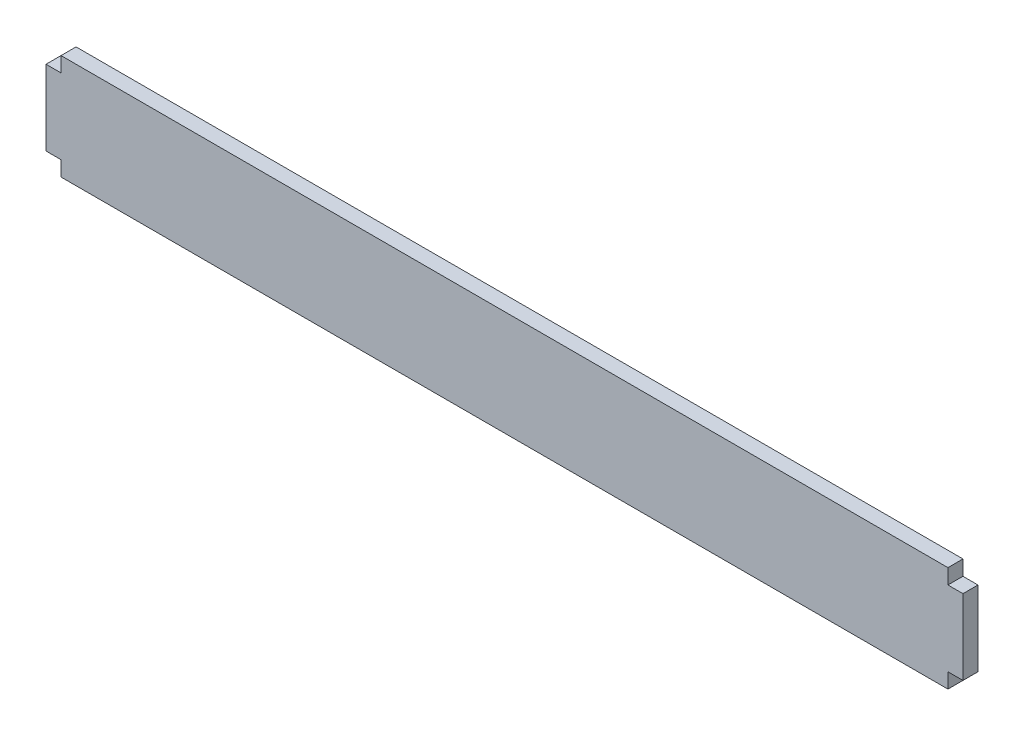
from build123d import *

# Parameters (mm, degrees)
SKETCH1_W           = 295
SKETCH1_H           = 35
SKETCH1_W_2         = 5
SKETCH1_H_2         = 25
BOSS_EXTRUDE1_DEPTH = 5


with BuildPart() as part:
    # Sketch1 → Boss-Extrude1 (new body)
    with BuildSketch(Plane.XY):
        with Locations((-147.5, 17.5)):
            Rectangle(SKETCH1_W, SKETCH1_H)
        with Locations((-297.5, 17.5)):
            Rectangle(SKETCH1_W_2, SKETCH1_H_2)
        with Locations((2.5, 17.5)):
            Rectangle(SKETCH1_W_2, SKETCH1_H_2)
    extrude(amount=BOSS_EXTRUDE1_DEPTH)


solid = part.part
